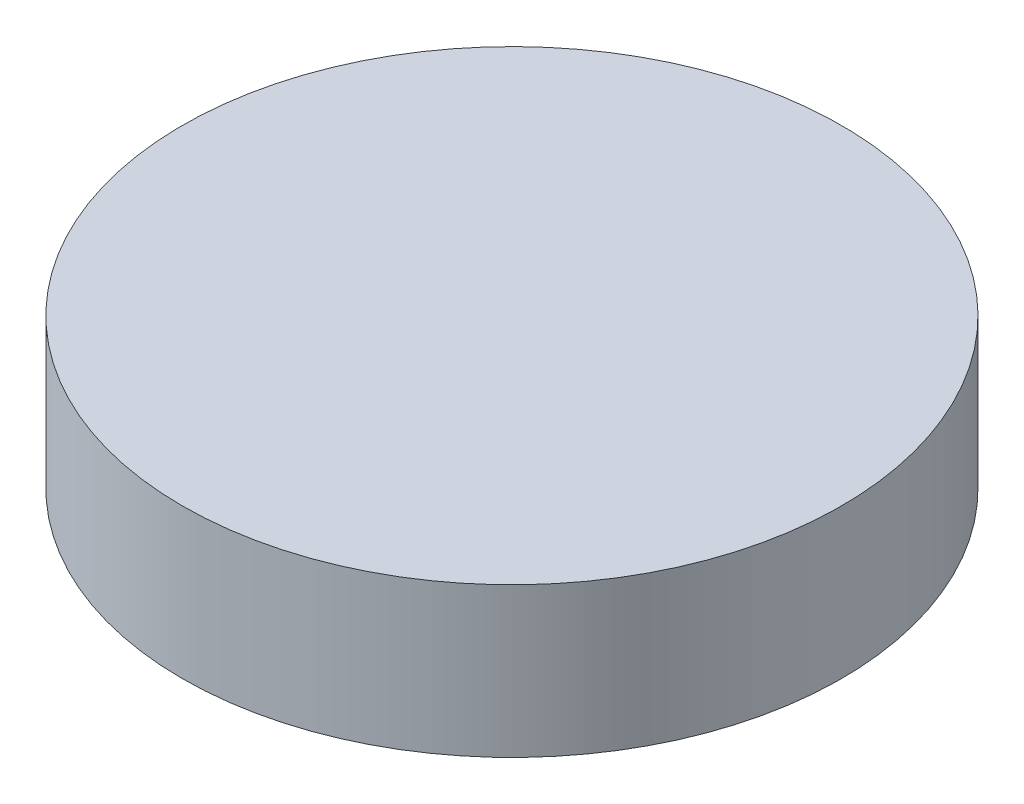
from build123d import *

# Parameters (mm, degrees)
SKETCH1_R           = 55.959375
BOSS_EXTRUDE1_DEPTH = 25.4


with BuildPart() as part:
    # Sketch1 → Boss-Extrude1 (new body)
    with BuildSketch(Plane(origin=(0, 0, 0), x_dir=(1, 0, 0), z_dir=(0, 1, 0))):
        with Locations(Location((0, 0, 0), (0, 0, 270))):
            Circle(SKETCH1_R)
    extrude(amount=BOSS_EXTRUDE1_DEPTH)


solid = part.part
